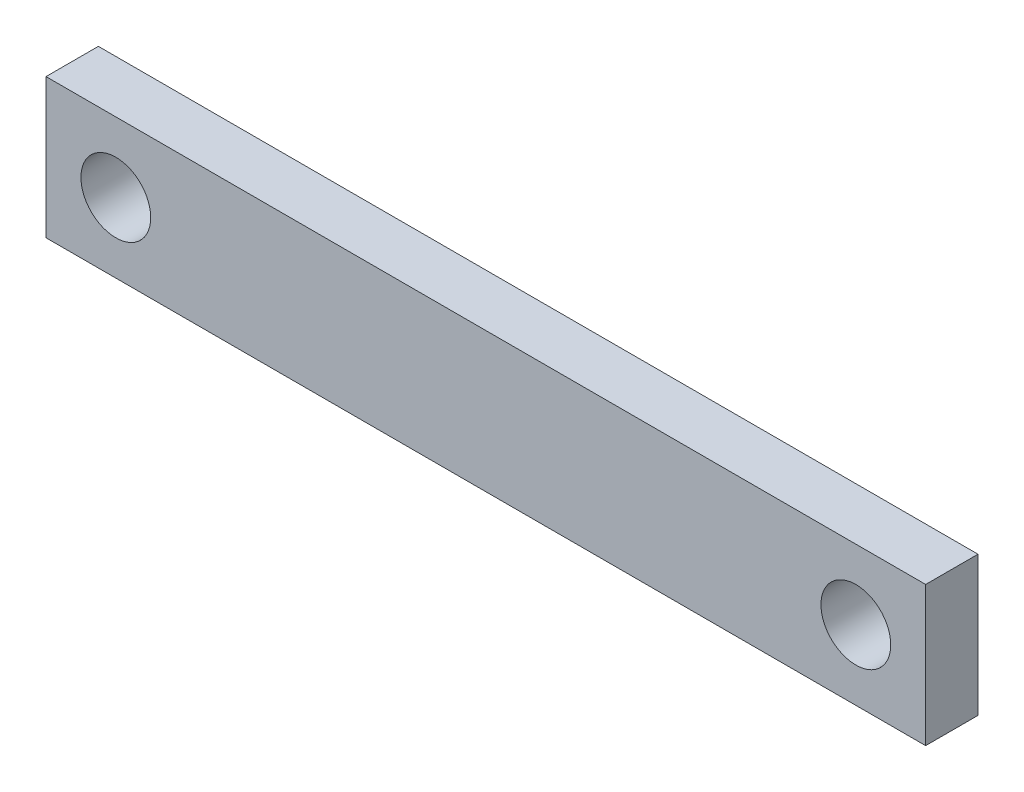
from build123d import *

# Parameters (mm, degrees)
SKETCH1_W                  = 177.8
SKETCH1_H                  = 25.4
BOSS_EXTRUDE1_DEPTH        = 9.525
F_1_2_0_5_DIAMETER_HOLE1_D = 12.7
SKETCH6_W                  = 17.78
SKETCH6_H                  = 25.4
CUT_EXTRUDE2_DEPTH         = 180.857514786


with BuildPart() as part:
    # Sketch1 → Boss-Extrude1 (new body)
    with BuildSketch(Plane.XY):
        with Locations((88.9, 12.7)):
            Rectangle(SKETCH1_W, SKETCH1_H)
    extrude(amount=BOSS_EXTRUDE1_DEPTH)

    # 1/2 (0.5) Diameter Hole1 (through all)
    with Locations(Plane.XY.offset(9.525)):
        with Locations((12.7, 12.7), (147.32, 12.7)):
            Hole(F_1_2_0_5_DIAMETER_HOLE1_D / 2)

    # Sketch6 → Cut-Extrude2 (cut, through all)
    with BuildSketch(Plane.XY.offset(9.525)):
        with Locations((168.91, 12.7)):
            Rectangle(SKETCH6_W, SKETCH6_H)
    extrude(amount=-CUT_EXTRUDE2_DEPTH, mode=Mode.SUBTRACT)


solid = part.part
